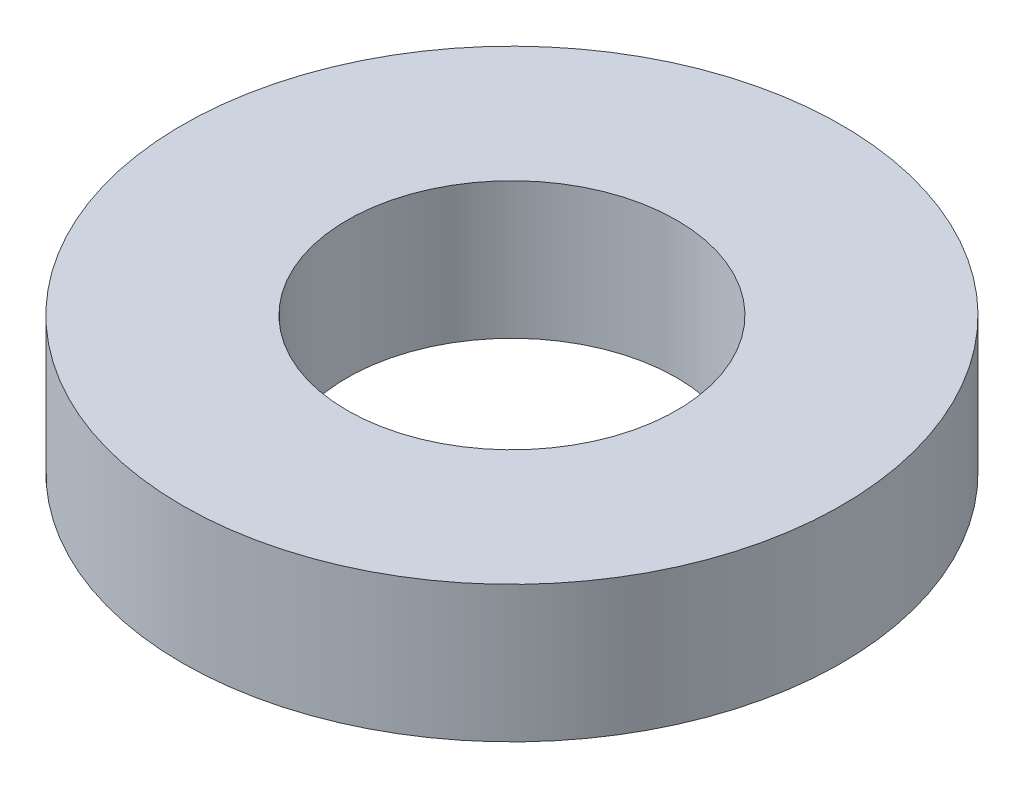
from build123d import *

# Parameters (mm, degrees)
SKETCH_1_R          = 5
EXTRUDE_1_DEPTH     = 2.07
SKETCH_2_R          = 2.5
CUT_EXTRUDE_1_DEPTH = 8.367828717


with BuildPart() as part:
    # 草图1 → 凸台-拉伸1 (new body)
    with BuildSketch(Plane(origin=(0, 0, 0), x_dir=(1, 0, 0), z_dir=(0, 1, 0))):
        with Locations(Location((0, 0, 0), (0, 0, 270))):
            Circle(SKETCH_1_R)
    extrude(amount=EXTRUDE_1_DEPTH)

    # 草图2 → 切除-拉伸1 (cut, through all)
    with BuildSketch(Plane(origin=(0, 2.07, 0), x_dir=(1, 0, 0), z_dir=(0, 1, 0))):
        with Locations(Location((0, 0, 0), (0, 0, 270))):
            Circle(SKETCH_2_R)
    extrude(amount=-CUT_EXTRUDE_1_DEPTH, mode=Mode.SUBTRACT)


solid = part.part
